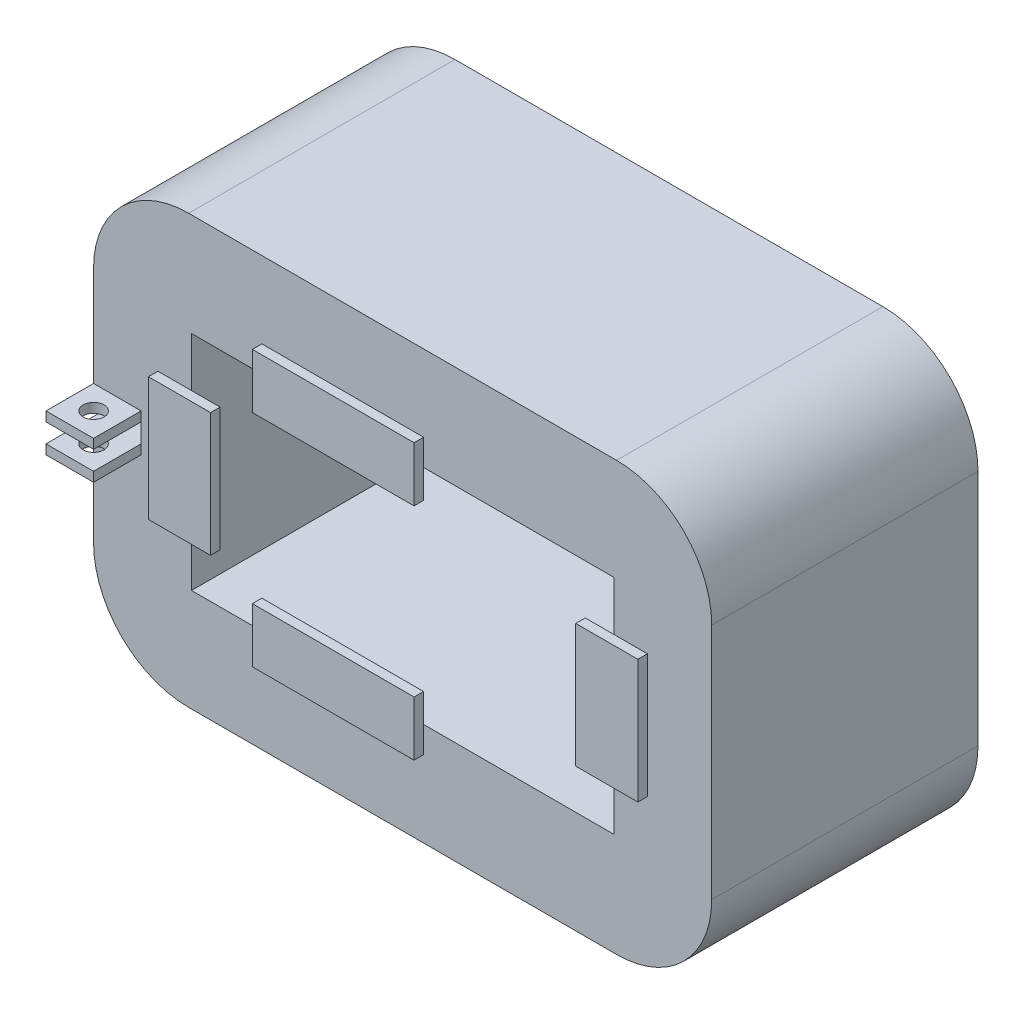
from build123d import *

# Parameters (mm, degrees)
SKETCH_1_W               = 65
SKETCH_1_H               = 45
EXTRUDE_1_DEPTH          = 28
SKETCH_2_W               = 44.4
SKETCH_2_H               = 23.4
CUT_EXTRUDE_1_DEPTH      = 39
FILLET_1_R               = 10
FILLET_2_R               = 10
FILLET_3_R               = 10
FILLET_4_R               = 10
EXTRUDE_6_DEPTH          = 1
EXTRUDE_6_2_DEPTH        = 1
EXTRUDE_6_3_DEPTH        = 1
SKETCH_10_W              = 17
SKETCH_10_H              = 5.754584259
EXTRUDE_6_4_DEPTH        = 1
CUT_EXTRUDE_3_DEPTH      = 1
CUT_EXTRUDE_3_DEPTH_BACK = 1
SKETCH_19_W              = 5
SKETCH_19_H              = 30.097075205
SKETCH_20_W              = 5
SKETCH_20_H              = 1
EXTRUDE_12_DEPTH         = 5
SKETCH_21_W              = 5
SKETCH_21_H              = 1
EXTRUDE_13_DEPTH         = 5
CUT_EXTRUDE_4_DEPTH      = 5
CUT_EXTRUDE_4_DEPTH_BACK = 5
SKETCH_22_R              = 1.1


with BuildPart() as part:
    # 草圖1 → 填料-伸長1 (new body)
    with BuildSketch(Plane.XY):
        with Locations((-27.434655272, 0)):
            Rectangle(SKETCH_1_W, SKETCH_1_H)
    extrude(amount=EXTRUDE_1_DEPTH)

    # 草圖2 → 除料-伸長1 (cut)
    with BuildSketch(Plane.XY):
        with Locations((-27.434655272, 0)):
            Rectangle(SKETCH_2_W, SKETCH_2_H)
    extrude(amount=CUT_EXTRUDE_1_DEPTH, mode=Mode.SUBTRACT)

    # 圓角1
    fillet_1_edges = [part.edges().sort_by_distance(p)[0] for p in [
        (-59.934655272, -22.5, 14),
    ]]
    fillet(fillet_1_edges, radius=FILLET_1_R)

    # 圓角2
    fillet_2_edges = [part.edges().sort_by_distance(p)[0] for p in [
        (-59.934655272, 22.5, 14),
    ]]
    fillet(fillet_2_edges, radius=FILLET_2_R)

    # 圓角3
    fillet_3_edges = [part.edges().sort_by_distance(p)[0] for p in [
        (5.065344728, 22.5, 14),
    ]]
    fillet(fillet_3_edges, radius=FILLET_3_R)

    # 圓角4
    fillet_4_edges = [part.edges().sort_by_distance(p)[0] for p in [
        (5.065344728, -22.5, 14),
    ]]
    fillet(fillet_4_edges, radius=FILLET_4_R)

    # 草圖19 → 除料-伸長3 (cut, two sides: drawn at the far end of the back side and taken through both)
    with BuildSketch(Plane(origin=(0, 0, 0), x_dir=(1, 0, 0), z_dir=(0, 1, 0)).offset(-CUT_EXTRUDE_3_DEPTH_BACK)):
        with Locations((-57.434655272, -13.951462398)):
            Rectangle(SKETCH_19_W, SKETCH_19_H)
    extrude(amount=CUT_EXTRUDE_3_DEPTH + CUT_EXTRUDE_3_DEPTH_BACK, mode=Mode.SUBTRACT)

    # 草圖20 → 填料-伸長12 (add)
    with BuildSketch(Plane.XY):
        with Locations((-57.434655272, 1.5)):
            Rectangle(SKETCH_20_W, SKETCH_20_H)
        with Locations((-57.434655272, -1.5)):
            Rectangle(SKETCH_20_W, SKETCH_20_H)
    extrude(amount=-EXTRUDE_12_DEPTH)

    # 草圖21 → 填料-伸長13 (add)
    with BuildSketch(Plane.XY.offset(28)):
        with Locations((-57.434655272, 1.5)):
            Rectangle(SKETCH_21_W, SKETCH_21_H)
        with Locations((-57.434655272, -1.5)):
            Rectangle(SKETCH_21_W, SKETCH_21_H)
    extrude(amount=EXTRUDE_13_DEPTH)

    # 草圖22 → 除料-伸長4 (cut, two sides: drawn at the far end of the back side and taken through both)
    with BuildSketch(Plane(origin=(0, 0, 0), x_dir=(1, 0, 0), z_dir=(0, 1, 0)).offset(-CUT_EXTRUDE_4_DEPTH_BACK)):
        with Locations(Location((-57.434655272, -30.5, 0), (0, 0, 270))):
            Circle(SKETCH_22_R)
        with Locations(Location((-57.434655272, 2.5, 0), (0, 0, 90))):
            Circle(SKETCH_22_R)
    extrude(amount=CUT_EXTRUDE_4_DEPTH + CUT_EXTRUDE_4_DEPTH_BACK, mode=Mode.SUBTRACT)


with BuildPart() as body_2:
    # 草圖10 → 填料-伸長6 (new body)
    with BuildSketch(Plane.XY.offset(29)):
        Polygon((-49.634655272, 6.5), (-53.165057103, 6.5), (-53.165057103, -6.5), (-46.634655272, -6.5), (-46.634655272, 6.5), align=None)
    extrude(amount=-EXTRUDE_6_DEPTH)


with BuildPart() as body_3:
    # 草圖10 → Extrude 6 2 (new body)
    with BuildSketch(Plane.XY.offset(29)):
        Polygon((-42.234655272, -11.7), (-42.234655272, -8.7), (-25.234655272, -8.7), (-25.234655272, -14.454584259), (-42.234655272, -14.454584259), align=None)
    extrude(amount=-EXTRUDE_6_2_DEPTH)


with BuildPart() as body_4:
    # 草圖10 → Extrude 6 3 (new body)
    with BuildSketch(Plane.XY.offset(29)):
        Polygon((-8.234655272, 6.5), (-8.234655272, -6.5), (-5.234655272, -6.5), (-1.70425344, -6.5), (-1.70425344, 6.5), align=None)
    extrude(amount=-EXTRUDE_6_3_DEPTH)


with BuildPart() as body_5:
    # 草圖10 → Extrude 6 4 (new body)
    with BuildSketch(Plane.XY.offset(29)):
        with Locations((-33.734655272, 11.57729213)):
            Rectangle(SKETCH_10_W, SKETCH_10_H)
    extrude(amount=-EXTRUDE_6_4_DEPTH)


solid = Compound([part.part, body_2.part, body_3.part, body_4.part, body_5.part])
